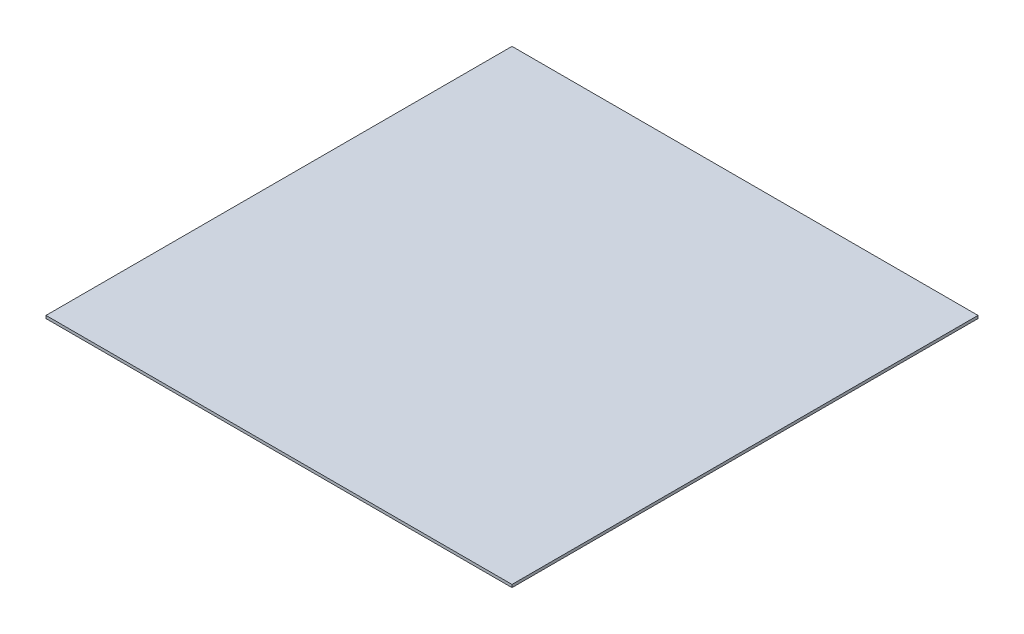
from build123d import *

# Parameters (mm, degrees)
SKETCH1_W           = 250
SKETCH1_H           = 250
BOSS_EXTRUDE1_DEPTH = 0.75


with BuildPart() as part:
    # Sketch1 → Boss-Extrude1 (new, symmetric)
    with BuildSketch(Plane(origin=(0, 0, 0), x_dir=(1, 0, 0), z_dir=(0, 1, 0))):
        Rectangle(SKETCH1_W, SKETCH1_H)
    extrude(amount=BOSS_EXTRUDE1_DEPTH, both=True)


solid = part.part
